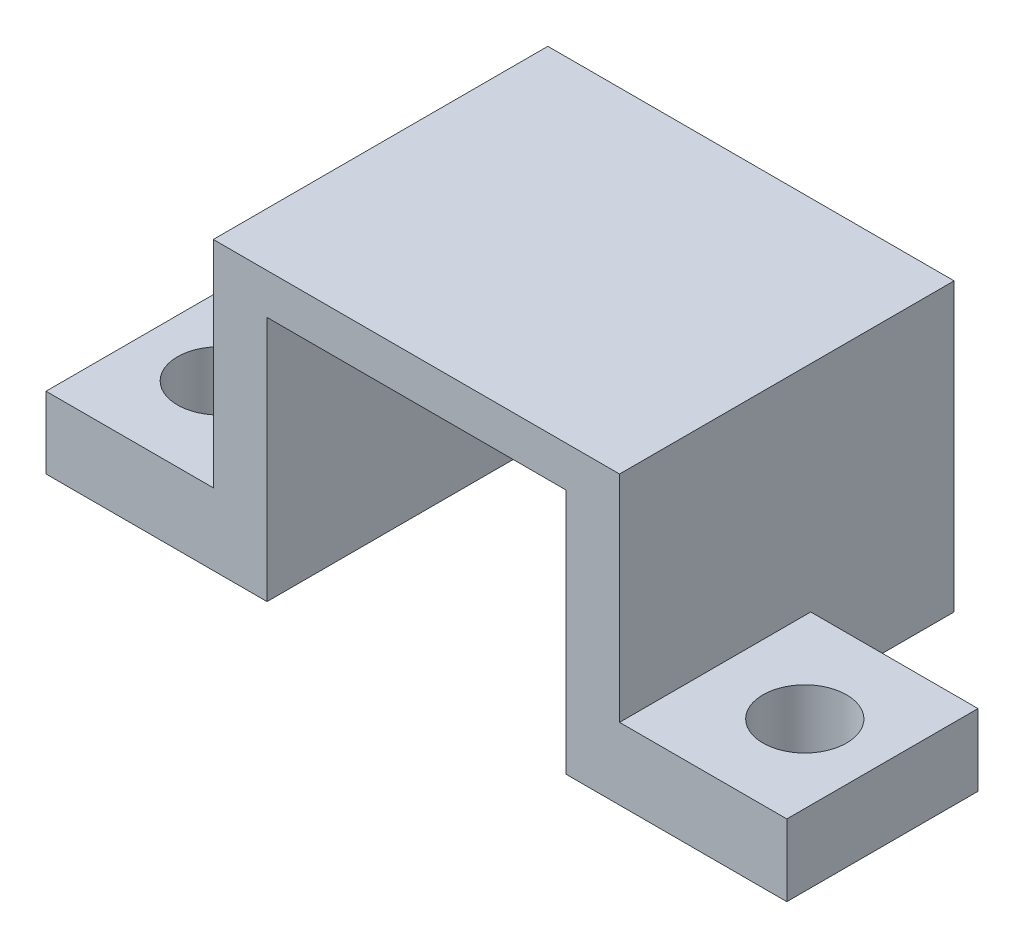
from build123d import *

# Parameters (mm, degrees)
ESBO_O1_W                = 17.000001856
ESBO_O1_H                = 13.999999967
RESSALTO_EXTRUS_O1_DEPTH = 12.000000396
ESBO_O2_W                = 12.500001117
ESBO_O2_H                = 10.30000049
CORTE_EXTRUS_O1_DEPTH    = 31.265532711
ESBO_O3_W                = 7.999999915
ESBO_O3_H                = 3.000000085
RESSALTO_EXTRUS_O2_DEPTH = 6.999999285
ESBO_O4_R                = 1.75
CORTE_EXTRUS_O2_DEPTH    = 31.265524303
ESBO_O5_W                = 7.999999915
ESBO_O5_H                = 3.000000085
RESSALTO_EXTRUS_O3_DEPTH = 6.999999285
ESBO_O6_R                = 1.75
CORTE_EXTRUS_O3_DEPTH    = 37.069409268


with BuildPart() as part:
    # Esboço1 → Ressalto-extrusão1 (new body)
    with BuildSketch(Plane.XZ.offset(-5e-05)):
        with Locations((15.500025358, 7.000024663)):
            Rectangle(ESBO_O1_W, ESBO_O1_H)
    extrude(amount=-RESSALTO_EXTRUS_O1_DEPTH)

    # Esboço2 → Corte-extrusão1 (cut, through all)
    with BuildSketch(Plane.XY.offset(14.000024647)):
        with Locations((15.500024893, 5.150050245)):
            Rectangle(ESBO_O2_W, ESBO_O2_H)
    extrude(amount=-CORTE_EXTRUS_O1_DEPTH, mode=Mode.SUBTRACT)

    # Esboço3 → Ressalto-extrusão2 (add)
    with BuildSketch(Plane.ZY.offset(-7.00002443)):
        with Locations((10.00002469, 1.500050043)):
            Rectangle(ESBO_O3_W, ESBO_O3_H)
    extrude(amount=RESSALTO_EXTRUS_O2_DEPTH)

    # Esboço4 → Corte-extrusão2 (cut, through all)
    with BuildSketch(Plane.XZ.offset(-5e-05)):
        with Locations(Location((3.250025213, 10.000025168, 0), (0, 0, 270))):
            Circle(ESBO_O4_R)
    extrude(amount=-CORTE_EXTRUS_O2_DEPTH, mode=Mode.SUBTRACT)

    # Esboço5 → Ressalto-extrusão3 (add)
    with BuildSketch(Plane(origin=(24.000026286, 0, 0), x_dir=(0, 0, -1), z_dir=(1, 0, 0))):
        with Locations((-10.00002469, 1.500050043)):
            Rectangle(ESBO_O5_W, ESBO_O5_H)
    extrude(amount=RESSALTO_EXTRUS_O3_DEPTH)

    # Esboço6 → Corte-extrusão3 (cut, through all)
    with BuildSketch(Plane.XZ.offset(-5e-05)):
        with Locations(Location((27.751375675, 10.000025168, 0), (0, 0, 270))):
            Circle(ESBO_O6_R)
    extrude(amount=-CORTE_EXTRUS_O3_DEPTH, mode=Mode.SUBTRACT)


solid = part.part
